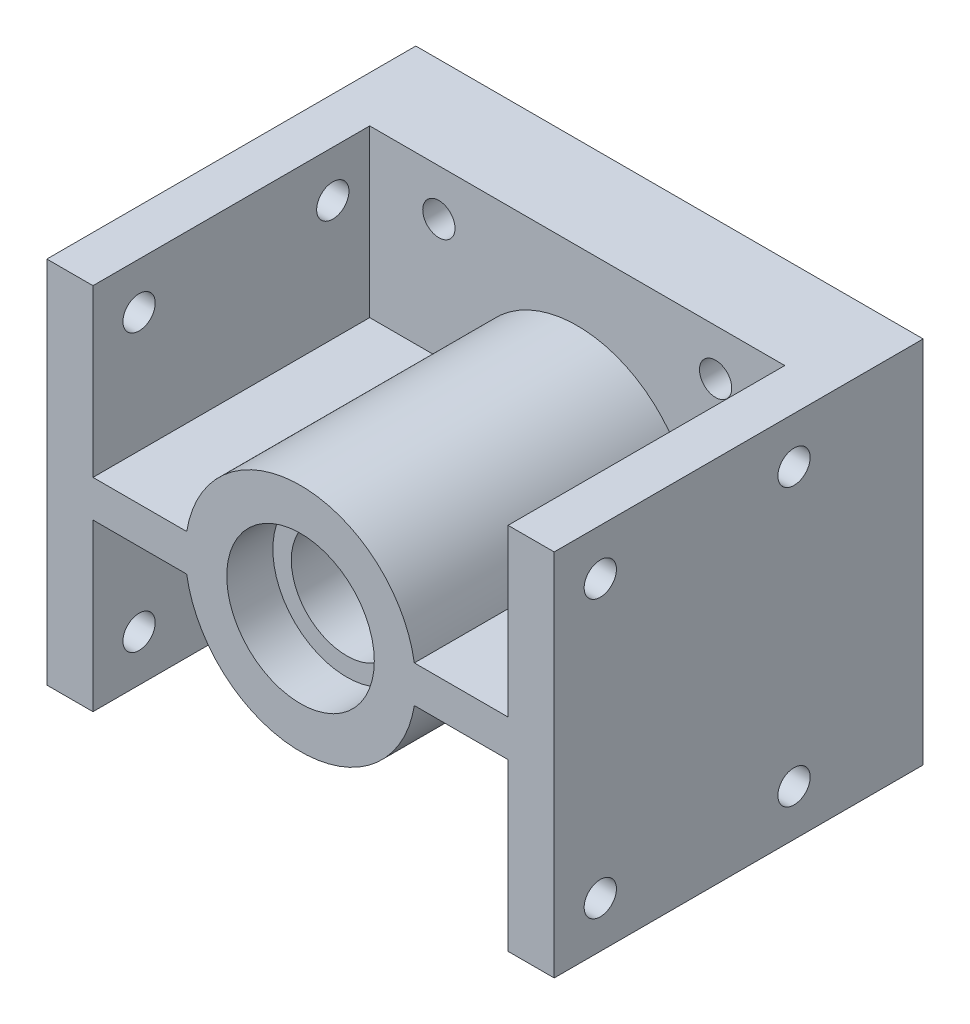
from build123d import *

# Parameters (mm, degrees)
SKETCH1_W           = 45
SKETCH1_H           = 40
BOSS_EXTRUDE1_DEPTH = 10
SKETCH2_W           = 5
SKETCH2_H           = 40
BOSS_EXTRUDE2_DEPTH = 40
SKETCH3_R           = 12.5
BOSS_EXTRUDE3_DEPTH = 30
SKETCH4_R           = 6
CUT_EXTRUDE1_DEPTH  = 53.5
SKETCH5_R           = 8
CUT_EXTRUDE2_DEPTH  = 5
SKETCH6_R           = 1.75
CUT_EXTRUDE3_DEPTH  = 53.5
SKETCH7_W           = 11
SKETCH7_H           = 4
BOSS_EXTRUDE4_DEPTH = 30
SKETCH8_R           = 1.75
CUT_EXTRUDE4_DEPTH  = 71.887234394


with BuildPart() as part:
    # Sketch1 → Boss-Extrude1 (new body)
    with BuildSketch(Plane.XY):
        Rectangle(SKETCH1_W, SKETCH1_H)
    extrude(amount=BOSS_EXTRUDE1_DEPTH)

    # Sketch2 → Boss-Extrude2 (add)
    with BuildSketch(Plane.XY):
        with Locations((-25, 0)):
            Rectangle(SKETCH2_W, SKETCH2_H)
        with Locations((25, 0)):
            Rectangle(SKETCH2_W, SKETCH2_H)
    extrude(amount=BOSS_EXTRUDE2_DEPTH)

    # Sketch3 → Boss-Extrude3 (add)
    with BuildSketch(Plane.XY.offset(10)):
        Circle(SKETCH3_R)
    extrude(amount=BOSS_EXTRUDE3_DEPTH)

    # Sketch4 → Cut-Extrude1 (cut, through all)
    with BuildSketch(Plane(origin=(0, 0, 0), x_dir=(-1, 0, 0), z_dir=(0, 0, -1))):
        Circle(SKETCH4_R)
    extrude(amount=-CUT_EXTRUDE1_DEPTH, mode=Mode.SUBTRACT)

    # Sketch5 → Cut-Extrude2 (cut)
    with BuildSketch(Plane.XY.offset(40)):
        Circle(SKETCH5_R)
    extrude(amount=-CUT_EXTRUDE2_DEPTH, mode=Mode.SUBTRACT)

    # Sketch6 → Cut-Extrude3 (cut, through all)
    with BuildSketch(Plane(origin=(0, 0, 0), x_dir=(-1, 0, 0), z_dir=(0, 0, -1))):
        with Locations((-15, 15)):
            Circle(SKETCH6_R)
        with Locations((15, 15)):
            Circle(SKETCH6_R)
        with Locations((15, -15)):
            Circle(SKETCH6_R)
        with Locations((-15, -15)):
            Circle(SKETCH6_R)
    extrude(amount=-CUT_EXTRUDE3_DEPTH, mode=Mode.SUBTRACT)

    # Sketch7 → Boss-Extrude4 (add)
    with BuildSketch(Plane.XY.offset(10)):
        with Locations((-17, 0)):
            Rectangle(SKETCH7_W, SKETCH7_H)
        with Locations((17, 0)):
            Rectangle(SKETCH7_W, SKETCH7_H)
    extrude(amount=BOSS_EXTRUDE4_DEPTH)

    # Sketch8 → Cut-Extrude4 (cut, through all)
    with BuildSketch(Plane.ZY.offset(27.5)):
        with Locations((35, 15)):
            Circle(SKETCH8_R)
        with Locations(Location((35, -15, 0), (0, 0, 90))):
            Circle(SKETCH8_R)
        with Locations((14, 15)):
            Circle(SKETCH8_R)
        with Locations(Location((14, -15, 0), (0, 0, 90))):
            Circle(SKETCH8_R)
    extrude(amount=-CUT_EXTRUDE4_DEPTH, mode=Mode.SUBTRACT)


solid = part.part
